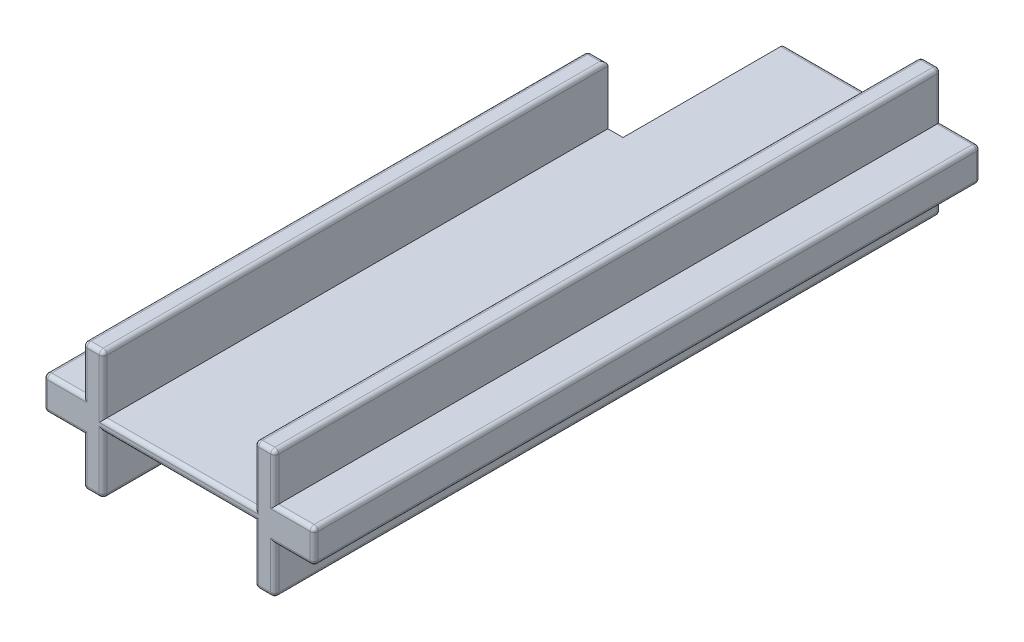
from build123d import *

# Parameters (mm, degrees)
AUFSATZ_LINEAR_AUSTRAGEN1_DEPTH = 25
SKIZZE2_W                       = 6
SKIZZE2_H                       = 1.65
AUFSATZ_LINEAR_AUSTRAGEN2_DEPTH = 8
SKIZZE3_W                       = 7.5
SKIZZE3_H                       = 0.55
SCHNITT_LINEAR_AUSTRAGEN1_DEPTH = 34.821697548
AUFSATZ_LINEAR_AUSTRAGEN3_DEPTH = 8
VERRUNDUNG1_R                   = 0.2


with BuildPart() as part:
    # Skizze1 → Aufsatz-Linear austragen1 (new body)
    with BuildSketch(Plane.XY):
        Polygon((-4.75, 0.825), (-6.7, 0.825), (-6.7, -0.825), (-4.75, -0.825), (-4.75, -3.165), (-3.75, -3.165), (-3.75, -0.825), (3.75, -0.825), (3.75, -3.165), (4.75, -3.165), (4.75, -0.825), (6.7, -0.825), (6.7, 0.825), (4.75, 0.825), (4.75, 3.165), (3.75, 3.165), (3.75, 0.825), (-3.75, 0.825), (-3.75, 3.165), (-4.75, 3.165), align=None)
    extrude(amount=AUFSATZ_LINEAR_AUSTRAGEN1_DEPTH)

    # Skizze2 → Aufsatz-Linear austragen2 (add)
    with BuildSketch(Plane(origin=(0, 0, 0), x_dir=(-1, 0, 0), z_dir=(0, 0, -1))):
        Rectangle(SKIZZE2_W, SKIZZE2_H)
    extrude(amount=AUFSATZ_LINEAR_AUSTRAGEN2_DEPTH)

    # Skizze3 → Schnitt-Linear austragen1 (cut, through all)
    with BuildSketch(Plane.XY.offset(25)):
        with Locations((0, -0.55)):
            Rectangle(SKIZZE3_W, SKIZZE3_H)
        with Locations((0, 0.55)):
            Rectangle(SKIZZE3_W, SKIZZE3_H)
    extrude(amount=-SCHNITT_LINEAR_AUSTRAGEN1_DEPTH, mode=Mode.SUBTRACT)

    # Skizze4 → Aufsatz-Linear austragen3 (add)
    with BuildSketch(Plane(origin=(0, 0, 0), x_dir=(-1, 0, 0), z_dir=(0, 0, -1))):
        Polygon((-3.75, -3.165), (-4.75, -3.165), (-4.75, -0.825), (-6.7, -0.825), (-6.7, 0.825), (-4.75, 0.825), (-4.75, 3.165), (-3.75, 3.165), (-3.75, 0.275), (-3, 0.275), (-3, -0.275), (-3.75, -0.275), align=None)
    extrude(amount=AUFSATZ_LINEAR_AUSTRAGEN3_DEPTH)

    # Verrundung1
    verrundung1_edges = [part.edges().sort_by_distance(p)[0] for p in [
        (4.25, -3.165, -8),
        (3.75, -1.72, -8),
        (3.75, 1.72, -8),
        (4.25, 3.165, -8),
        (4.75, 1.995, -8),
        (5.725, 0.825, -8),
        (6.7, 0, -8),
        (5.725, -0.825, -8),
        (4.75, -1.995, -8),
        (-4.75, -1.995, 25),
        (-4.25, -3.165, 25),
        (-5.725, 0.825, 0),
        (-4.75, 1.995, 0),
        (-4.25, 3.165, 0),
        (-3.75, -1.72, 25),
        (-4.25, -3.165, 0),
        (-4.75, -1.995, 0),
        (-5.725, -0.825, 0),
        (-6.7, 0, 0),
        (3.75, -1.72, 25),
        (4.25, -3.165, 25),
        (-6.7, 0.825, 12.5),
        (-4.75, 3.165, 12.5),
        (-3.75, 3.165, 12.5),
        (3.75, 3.165, 8.5),
        (4.75, 3.165, 8.5),
        (6.7, 0.825, 8.5),
        (6.7, -0.825, 8.5),
        (4.75, -3.165, 8.5),
        (3.75, -3.165, 8.5),
        (-3.75, -3.165, 12.5),
        (-4.75, -3.165, 12.5),
        (-6.7, -0.825, 12.5),
        (4.75, -1.995, 25),
        (5.725, -0.825, 25),
        (6.7, 0, 25),
        (5.725, 0.825, 25),
        (-6.7, 0, 25),
        (4.75, 1.995, 25),
        (4.25, 3.165, 25),
        (3.75, 1.72, 25),
        (-3.75, 1.72, 25),
        (-3, 0, -8),
        (0.375, 0.275, -8),
        (0.375, -0.275, -8),
        (-4.25, 3.165, 25),
        (-4.75, 1.995, 25),
        (-5.725, 0.825, 25),
        (0, -0.275, 25),
        (-5.725, -0.825, 25),
        (0, 0.275, 25),
    ]]
    fillet(verrundung1_edges, radius=VERRUNDUNG1_R)


solid = part.part
